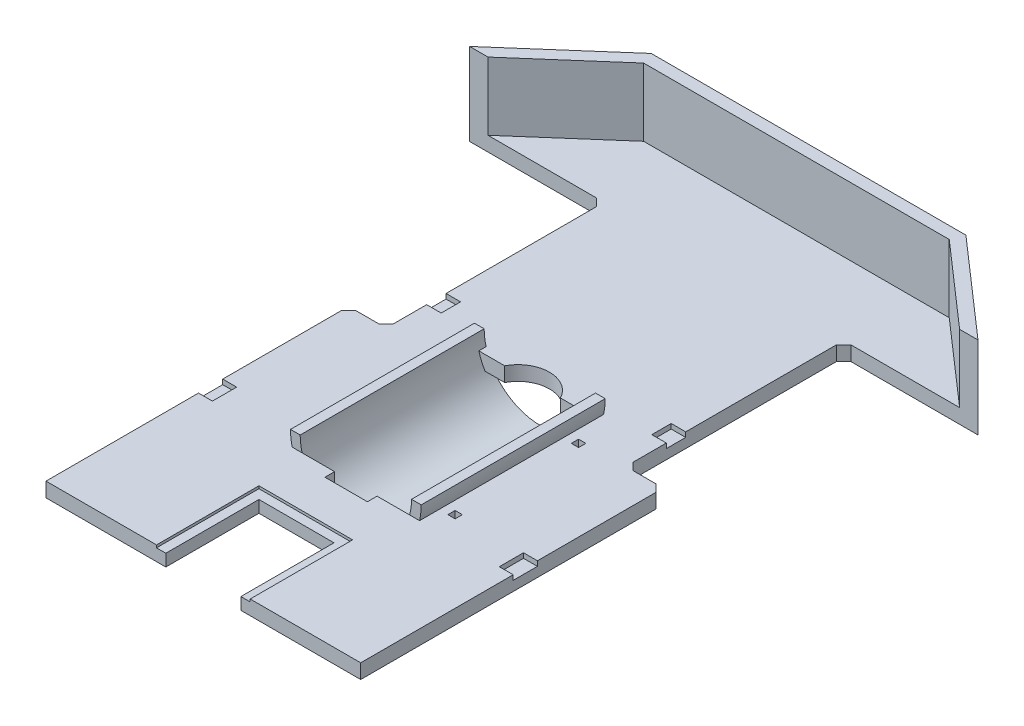
from build123d import *

# Parameters (mm, degrees)
BOSS_EXTRUDE1_DEPTH      = 6
BOSS_EXTRUDE2_DEPTH      = 28
SKETCH5_W                = 15.5
SKETCH5_H                = 90
CUT_EXTRUDE2_DEPTH       = 273.596771808
CHAMFER2_SIZE            = 3
SKETCH8_W                = 46
SKETCH8_H                = 73
CUT_EXTRUDE4_DEPTH       = 23
BOSS_EXTRUDE5_DEPTH      = 73
BOSS_EXTRUDE5_DEPTH_BACK = 3
BOSS_EXTRUDE5_START      = 114
BOSS_EXTRUDE6_DEPTH      = 18.95
SKETCH11_W               = 31
SKETCH11_H               = 38.46
CUT_EXTRUDE5_DEPTH       = 19.03
CUT_EXTRUDE7_START       = 18.95
CUT_EXTRUDE7_DEPTH       = 20
CUT_EXTRUDE8_REACH       = 274.597
CUT_EXTRUDE9_REACH       = 274.597
SKETCH13_W               = 17.55
SKETCH13_H               = 4
CUT_EXTRUDE10_REACH      = 274.597
SKETCH14_W               = 3
SKETCH14_H               = 3
SKETCH15_W               = 6
SKETCH15_H               = 8
SKETCH15_W_2             = 5.75
SKETCH15_H_2             = 10
CUT_EXTRUDE11_DEPTH      = 2


with BuildPart() as part:
    # Sketch1 → Boss-Extrude1 (new body)
    with BuildSketch(Plane(origin=(0, 0, 0), x_dir=(1, 0, 0), z_dir=(0, 1, 0))):
        Polygon((105, -35), (65, 0), (0, 0), (0, -250), (65, -250), (65, -35), align=None)
        Polygon((0, -250), (0, 0), (-65, 0), (-105, -35), (-65, -35), (-65, -250), align=None)
    extrude(amount=BOSS_EXTRUDE1_DEPTH)

    # Sketch2 → Boss-Extrude2 (add)
    with BuildSketch(Plane(origin=(0, 6, 0), x_dir=(1, 0, 0), z_dir=(0, 1, 0))):
        Polygon((-105, -35), (-97.407038705, -35), (-63.121324419, -5), (63.121324419, -5), (97.407038705, -35), (105, -35), (65, 0), (-65, 0), align=None)
    extrude(amount=BOSS_EXTRUDE2_DEPTH)

    # Sketch5 → Cut-Extrude2 (cut, through all)
    with BuildSketch(Plane(origin=(0, 6, 0), x_dir=(1, 0, 0), z_dir=(0, 1, 0))):
        with Locations((-57.25, -80)):
            Rectangle(SKETCH5_W, SKETCH5_H)
        with Locations((57.25, -80)):
            Rectangle(SKETCH5_W, SKETCH5_H)
    extrude(amount=-CUT_EXTRUDE2_DEPTH, mode=Mode.SUBTRACT)

    # Chamfer2
    chamfer2_edges = [part.edges().sort_by_distance(p)[0] for p in [
        (-65, 3, 125),
        (-49.5, 3, 35),
        (-49.5, 3, 125),
        (65, 3, 125),
        (49.5, 3, 125),
        (49.5, 3, 35),
    ]]
    chamfer(chamfer2_edges, length=CHAMFER2_SIZE)

    # Sketch8 → Cut-Extrude4 (cut)
    with BuildSketch(Plane(origin=(0, 6, 0), x_dir=(1, 0, 0), z_dir=(0, 1, 0))):
        with Locations((0, -150.5)):
            Rectangle(SKETCH8_W, SKETCH8_H)
    extrude(amount=-CUT_EXTRUDE4_DEPTH, mode=Mode.SUBTRACT)

    # Sketch9 → Boss-Extrude5 (add, two sides: drawn at the far end of the back side and taken through both)
    with BuildSketch(Plane.XY.offset(BOSS_EXTRUDE5_START - BOSS_EXTRUDE5_DEPTH_BACK)):
        with BuildLine():
            Line((-27, 12), (-23, 12))
            ThreePointArc((-23, 12), (0, -11), (23, 12))
            Line((23, 12), (27, 12))
            ThreePointArc((27, 12), (0, -15), (-27, 12))
        make_face()
    extrude(amount=BOSS_EXTRUDE5_DEPTH + BOSS_EXTRUDE5_DEPTH_BACK)

    # Sketch10 → Boss-Extrude6 (add)
    with BuildSketch(Plane(origin=(0, 6, 0), x_dir=(1, 0, 0), z_dir=(0, 1, 0))):
        Polygon((-19.35, -250), (-19.35, -207.69), (19.35, -207.69), (19.35, -250), (15.5, -250), (15.5, -211.54), (-15.5, -211.54), (-15.5, -250), align=None)
    extrude(amount=BOSS_EXTRUDE6_DEPTH)

    # Sketch11 → Cut-Extrude5 (cut)
    with BuildSketch(Plane(origin=(0, 6, 0), x_dir=(1, 0, 0), z_dir=(0, 1, 0))):
        with Locations((0, -230.77)):
            Rectangle(SKETCH11_W, SKETCH11_H)
    extrude(amount=-CUT_EXTRUDE5_DEPTH, mode=Mode.SUBTRACT)

    # Sketch10<3> → Cut-Extrude7 (cut)
    with BuildSketch(Plane(origin=(0, 6, 0), x_dir=(1, 0, 0), z_dir=(0, 1, 0)).offset(CUT_EXTRUDE7_START)):
        Polygon((-19.35, -250), (-19.35, -207.69), (19.35, -207.69), (19.35, -250), (15.5, -250), (15.5, -211.54), (-15.5, -211.54), (-15.5, -250), align=None)
    extrude(amount=-CUT_EXTRUDE7_DEPTH, mode=Mode.SUBTRACT)

    # Sketch12 → Cut-Extrude8 (cut, up to next)
    with BuildSketch(Plane(origin=(0, 6, 0), x_dir=(1, 0, 0), z_dir=(0, 1, 0)), mode=Mode.PRIVATE) as cut_extrude8_sk1:
        with BuildLine():
            Line((-11.5, -114), (11.5, -114))
            ThreePointArc((11.5, -114), (0, -107.028878229), (-11.5, -114))
        make_face()
    cut_extrude8_tool1 = extrude(cut_extrude8_sk1.sketch, amount=-CUT_EXTRUDE8_REACH, mode=Mode.PRIVATE) & part.part
    add(cut_extrude8_tool1.solids().sort_by_distance((0, 6, 111.135325))[0], mode=Mode.SUBTRACT)

    # Sketch13 → Cut-Extrude9 (cut, up to next)
    with BuildSketch(Plane(origin=(0, 6, 0), x_dir=(1, 0, 0), z_dir=(0, 1, 0)), mode=Mode.PRIVATE) as cut_extrude9_sk1:
        with Locations((0, -189)):
            Rectangle(SKETCH13_W, SKETCH13_H)
    cut_extrude9_tool1 = extrude(cut_extrude9_sk1.sketch, amount=-CUT_EXTRUDE9_REACH, mode=Mode.PRIVATE) & part.part
    add(cut_extrude9_tool1.solids().sort_by_distance((0, 6, 189))[0], mode=Mode.SUBTRACT)

    # Sketch14 → Cut-Extrude10 (cut, up to next)
    with BuildSketch(Plane(origin=(0, 6, 0), x_dir=(1, 0, 0), z_dir=(0, 1, 0)), mode=Mode.PRIVATE) as cut_extrude10_sk1:
        with Locations((-31.5, -126.5)):
            Rectangle(SKETCH14_W, SKETCH14_H)
    cut_extrude10_tool1 = extrude(cut_extrude10_sk1.sketch, amount=-CUT_EXTRUDE10_REACH, mode=Mode.PRIVATE) & part.part
    # Sketch14 → Cut-Extrude10 (cut, up to next)
    with BuildSketch(Plane(origin=(0, 6, 0), x_dir=(1, 0, 0), z_dir=(0, 1, 0)), mode=Mode.PRIVATE) as cut_extrude10_sk2:
        with Locations((-31.5, -177.5)):
            Rectangle(SKETCH14_W, SKETCH14_H)
    cut_extrude10_tool2 = extrude(cut_extrude10_sk2.sketch, amount=-CUT_EXTRUDE10_REACH, mode=Mode.PRIVATE) & part.part
    # Sketch14 → Cut-Extrude10 (cut, up to next)
    with BuildSketch(Plane(origin=(0, 6, 0), x_dir=(1, 0, 0), z_dir=(0, 1, 0)), mode=Mode.PRIVATE) as cut_extrude10_sk3:
        with Locations((31.5, -126.5)):
            Rectangle(SKETCH14_W, SKETCH14_H)
    cut_extrude10_tool3 = extrude(cut_extrude10_sk3.sketch, amount=-CUT_EXTRUDE10_REACH, mode=Mode.PRIVATE) & part.part
    # Sketch14 → Cut-Extrude10 (cut, up to next)
    with BuildSketch(Plane(origin=(0, 6, 0), x_dir=(1, 0, 0), z_dir=(0, 1, 0)), mode=Mode.PRIVATE) as cut_extrude10_sk4:
        with Locations((31.5, -177.5)):
            Rectangle(SKETCH14_W, SKETCH14_H)
    cut_extrude10_tool4 = extrude(cut_extrude10_sk4.sketch, amount=-CUT_EXTRUDE10_REACH, mode=Mode.PRIVATE) & part.part
    add(cut_extrude10_tool1.solids().sort_by_distance((-31.5, 6, 126.5))[0], mode=Mode.SUBTRACT)
    add(cut_extrude10_tool2.solids().sort_by_distance((-31.5, 6, 177.5))[0], mode=Mode.SUBTRACT)
    add(cut_extrude10_tool3.solids().sort_by_distance((31.5, 6, 126.5))[0], mode=Mode.SUBTRACT)
    add(cut_extrude10_tool4.solids().sort_by_distance((31.5, 6, 177.5))[0], mode=Mode.SUBTRACT)

    # Sketch15 → Cut-Extrude11 (cut)
    with BuildSketch(Plane(origin=(0, 6, 0), x_dir=(1, 0, 0), z_dir=(0, 1, 0))):
        with Locations((-46.5, -104.24941096)):
            Rectangle(SKETCH15_W, SKETCH15_H)
        with Locations((-62.125, -182)):
            Rectangle(SKETCH15_W_2, SKETCH15_H_2)
        with Locations((62.125, -182)):
            Rectangle(SKETCH15_W_2, SKETCH15_H_2)
        with Locations((46.5, -104.24941096)):
            Rectangle(SKETCH15_W, SKETCH15_H)
    extrude(amount=-CUT_EXTRUDE11_DEPTH, mode=Mode.SUBTRACT)


solid = part.part
